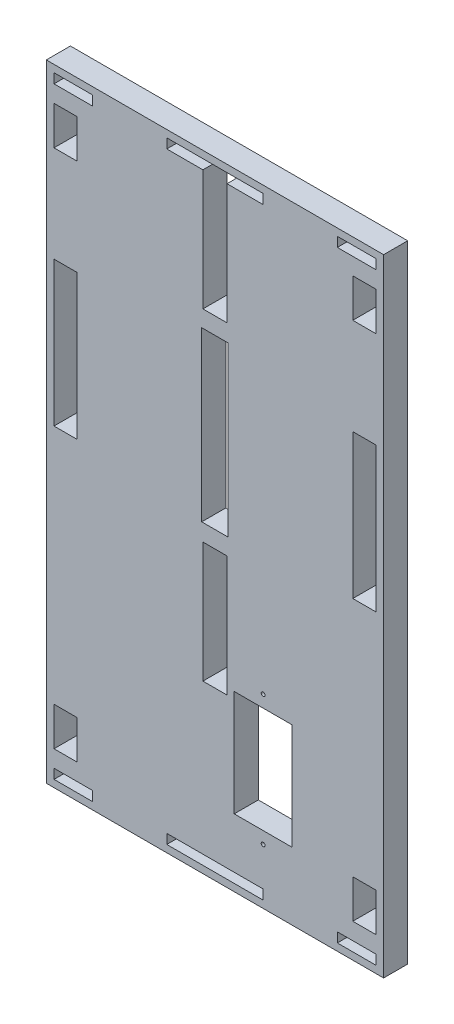
from build123d import *

# Parameters (mm, degrees)
SKETCH1_W           = 70
SKETCH1_H           = 130
SKETCH1_W_2         = 5
SKETCH1_H_2         = 25
SKETCH1_W_3         = 5.5
SKETCH1_H_3         = 34.894660298
BOSS_EXTRUDE1_DEPTH = 5
CUT_EXTRUDE1_REACH  = 205.568
SKETCH2_W           = 4.8
SKETCH2_H           = 8
SKETCH2_H_2         = 30
SKETCH2_W_2         = 8
SKETCH2_H_3         = 2
SKETCH2_W_3         = 20
SKETCH2_W_4         = 12
SKETCH2_H_4         = 22
CUT_EXTRUDE2_REACH  = 205.568
SKETCH4_R           = 0.4


with BuildPart() as part:
    # Sketch1 → Boss-Extrude1 (new body)
    with BuildSketch(Plane.XY):
        with Locations((0, 135.474649456)):
            Rectangle(SKETCH1_W, SKETCH1_H)
        with Locations((0, 184.474649456)):
            Rectangle(SKETCH1_W_2, SKETCH1_H_2, mode=Mode.SUBTRACT)
        with Locations((0, 117.579989158)):
            Rectangle(SKETCH1_W_2, SKETCH1_H_2, mode=Mode.SUBTRACT)
        with Locations((0, 151.027319307)):
            Rectangle(SKETCH1_W_3, SKETCH1_H_3, mode=Mode.SUBTRACT)
    extrude(amount=BOSS_EXTRUDE1_DEPTH)

    # Sketch2 → Cut-Extrude1 (cut, up to next)
    with BuildSketch(Plane.XY.offset(5), mode=Mode.PRIVATE) as cut_extrude1_sk1:
        with Locations((-31, 189.474649456)):
            Rectangle(SKETCH2_W, SKETCH2_H)
    cut_extrude1_tool1 = extrude(cut_extrude1_sk1.sketch, amount=-CUT_EXTRUDE1_REACH, mode=Mode.PRIVATE) & part.part
    # Sketch2 → Cut-Extrude1 (cut, up to next)
    with BuildSketch(Plane.XY.offset(5), mode=Mode.PRIVATE) as cut_extrude1_sk2:
        with Locations((-31, 150.474649456)):
            Rectangle(SKETCH2_W, SKETCH2_H_2)
    cut_extrude1_tool2 = extrude(cut_extrude1_sk2.sketch, amount=-CUT_EXTRUDE1_REACH, mode=Mode.PRIVATE) & part.part
    # Sketch2 → Cut-Extrude1 (cut, up to next)
    with BuildSketch(Plane.XY.offset(5), mode=Mode.PRIVATE) as cut_extrude1_sk3:
        with Locations((-29.4, 197.974649456)):
            Rectangle(SKETCH2_W_2, SKETCH2_H_3)
    cut_extrude1_tool3 = extrude(cut_extrude1_sk3.sketch, amount=-CUT_EXTRUDE1_REACH, mode=Mode.PRIVATE) & part.part
    # Sketch2 → Cut-Extrude1 (cut, up to next)
    with BuildSketch(Plane.XY.offset(5), mode=Mode.PRIVATE) as cut_extrude1_sk4:
        with Locations((-31, 81.474649456)):
            Rectangle(SKETCH2_W, SKETCH2_H)
    cut_extrude1_tool4 = extrude(cut_extrude1_sk4.sketch, amount=-CUT_EXTRUDE1_REACH, mode=Mode.PRIVATE) & part.part
    # Sketch2 → Cut-Extrude1 (cut, up to next)
    with BuildSketch(Plane.XY.offset(5), mode=Mode.PRIVATE) as cut_extrude1_sk5:
        with Locations((31, 81.474649456)):
            Rectangle(SKETCH2_W, SKETCH2_H)
    cut_extrude1_tool5 = extrude(cut_extrude1_sk5.sketch, amount=-CUT_EXTRUDE1_REACH, mode=Mode.PRIVATE) & part.part
    # Sketch2 → Cut-Extrude1 (cut, up to next)
    with BuildSketch(Plane.XY.offset(5), mode=Mode.PRIVATE) as cut_extrude1_sk6:
        with Locations((31, 150.474649456)):
            Rectangle(SKETCH2_W, SKETCH2_H_2)
    cut_extrude1_tool6 = extrude(cut_extrude1_sk6.sketch, amount=-CUT_EXTRUDE1_REACH, mode=Mode.PRIVATE) & part.part
    # Sketch2 → Cut-Extrude1 (cut, up to next)
    with BuildSketch(Plane.XY.offset(5), mode=Mode.PRIVATE) as cut_extrude1_sk7:
        with Locations((31, 189.474649456)):
            Rectangle(SKETCH2_W, SKETCH2_H)
    cut_extrude1_tool7 = extrude(cut_extrude1_sk7.sketch, amount=-CUT_EXTRUDE1_REACH, mode=Mode.PRIVATE) & part.part
    # Sketch2 → Cut-Extrude1 (cut, up to next)
    with BuildSketch(Plane.XY.offset(5), mode=Mode.PRIVATE) as cut_extrude1_sk8:
        with Locations((29.4, 197.974649456)):
            Rectangle(SKETCH2_W_2, SKETCH2_H_3)
    cut_extrude1_tool8 = extrude(cut_extrude1_sk8.sketch, amount=-CUT_EXTRUDE1_REACH, mode=Mode.PRIVATE) & part.part
    # Sketch2 → Cut-Extrude1 (cut, up to next)
    with BuildSketch(Plane.XY.offset(5), mode=Mode.PRIVATE) as cut_extrude1_sk9:
        with Locations((-29.4, 72.974649456)):
            Rectangle(SKETCH2_W_2, SKETCH2_H_3)
    cut_extrude1_tool9 = extrude(cut_extrude1_sk9.sketch, amount=-CUT_EXTRUDE1_REACH, mode=Mode.PRIVATE) & part.part
    # Sketch2 → Cut-Extrude1 (cut, up to next)
    with BuildSketch(Plane.XY.offset(5), mode=Mode.PRIVATE) as cut_extrude1_sk10:
        with Locations((0, 72.974649456)):
            Rectangle(SKETCH2_W_3, SKETCH2_H_3)
    cut_extrude1_tool10 = extrude(cut_extrude1_sk10.sketch, amount=-CUT_EXTRUDE1_REACH, mode=Mode.PRIVATE) & part.part
    # Sketch2 → Cut-Extrude1 (cut, up to next)
    with BuildSketch(Plane.XY.offset(5), mode=Mode.PRIVATE) as cut_extrude1_sk11:
        with Locations((29.4, 72.974649456)):
            Rectangle(SKETCH2_W_2, SKETCH2_H_3)
    cut_extrude1_tool11 = extrude(cut_extrude1_sk11.sketch, amount=-CUT_EXTRUDE1_REACH, mode=Mode.PRIVATE) & part.part
    # Sketch2 → Cut-Extrude1 (cut, up to next)
    with BuildSketch(Plane.XY.offset(5), mode=Mode.PRIVATE) as cut_extrude1_sk12:
        with Locations((0, 197.974649456)):
            Rectangle(SKETCH2_W_3, SKETCH2_H_3)
    cut_extrude1_tool12 = extrude(cut_extrude1_sk12.sketch, amount=-CUT_EXTRUDE1_REACH, mode=Mode.PRIVATE) & part.part
    # Sketch2 → Cut-Extrude1 (cut, up to next)
    with BuildSketch(Plane.XY.offset(5), mode=Mode.PRIVATE) as cut_extrude1_sk13:
        with Locations((10, 95.474649456)):
            Rectangle(SKETCH2_W_4, SKETCH2_H_4)
    cut_extrude1_tool13 = extrude(cut_extrude1_sk13.sketch, amount=-CUT_EXTRUDE1_REACH, mode=Mode.PRIVATE) & part.part
    add(cut_extrude1_tool1.solids().sort_by_distance((-31, 189.474649, 5))[0], mode=Mode.SUBTRACT)
    add(cut_extrude1_tool2.solids().sort_by_distance((-31, 150.474649, 5))[0], mode=Mode.SUBTRACT)
    add(cut_extrude1_tool3.solids().sort_by_distance((-29.4, 197.974649, 5))[0], mode=Mode.SUBTRACT)
    add(cut_extrude1_tool4.solids().sort_by_distance((-31, 81.474649, 5))[0], mode=Mode.SUBTRACT)
    add(cut_extrude1_tool5.solids().sort_by_distance((31, 81.474649, 5))[0], mode=Mode.SUBTRACT)
    add(cut_extrude1_tool6.solids().sort_by_distance((31, 150.474649, 5))[0], mode=Mode.SUBTRACT)
    add(cut_extrude1_tool7.solids().sort_by_distance((31, 189.474649, 5))[0], mode=Mode.SUBTRACT)
    add(cut_extrude1_tool8.solids().sort_by_distance((29.4, 197.974649, 5))[0], mode=Mode.SUBTRACT)
    add(cut_extrude1_tool9.solids().sort_by_distance((-29.4, 72.974649, 5))[0], mode=Mode.SUBTRACT)
    add(cut_extrude1_tool10.solids().sort_by_distance((0, 72.974649, 5))[0], mode=Mode.SUBTRACT)
    add(cut_extrude1_tool11.solids().sort_by_distance((29.4, 72.974649, 5))[0], mode=Mode.SUBTRACT)
    add(cut_extrude1_tool12.solids().sort_by_distance((0, 197.974649, 5))[0], mode=Mode.SUBTRACT)
    add(cut_extrude1_tool13.solids().sort_by_distance((10, 95.474649, 5))[0], mode=Mode.SUBTRACT)

    # Sketch4 → Cut-Extrude2 (cut, up to next)
    with BuildSketch(Plane.XY.offset(5), mode=Mode.PRIVATE) as cut_extrude2_sk1:
        with Locations((10, 81.974649456)):
            Circle(SKETCH4_R)
    cut_extrude2_tool1 = extrude(cut_extrude2_sk1.sketch, amount=-CUT_EXTRUDE2_REACH, mode=Mode.PRIVATE) & part.part
    # Sketch4 → Cut-Extrude2 (cut, up to next)
    with BuildSketch(Plane.XY.offset(5), mode=Mode.PRIVATE) as cut_extrude2_sk2:
        with Locations((10, 108.974649456)):
            Circle(SKETCH4_R)
    cut_extrude2_tool2 = extrude(cut_extrude2_sk2.sketch, amount=-CUT_EXTRUDE2_REACH, mode=Mode.PRIVATE) & part.part
    add(cut_extrude2_tool1.solids().sort_by_distance((10, 81.974649, 5))[0], mode=Mode.SUBTRACT)
    add(cut_extrude2_tool2.solids().sort_by_distance((10, 108.974649, 5))[0], mode=Mode.SUBTRACT)


solid = part.part
